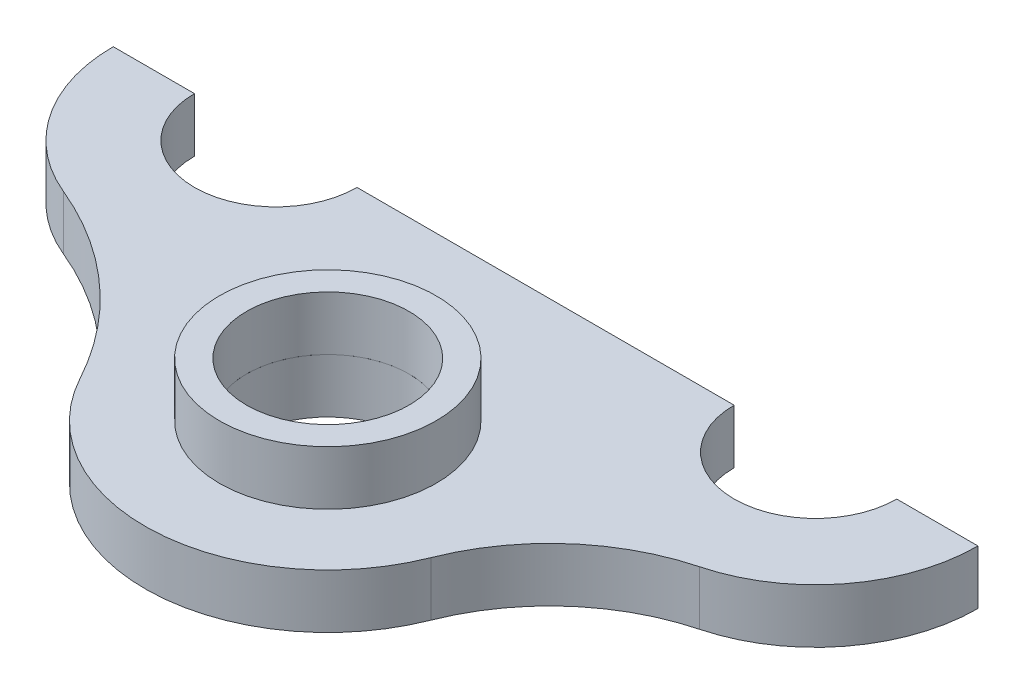
from build123d import *

# Parameters (mm, degrees)
SKETCH1_R           = 2.38125
BOSS_EXTRUDE1_DEPTH = 1.5875
SKETCH2_R           = 3.175
BOSS_EXTRUDE2_DEPTH = 1.5875
SKETCH3_R           = 2.38125
BOSS_EXTRUDE3_DEPTH = 19.05
SKETCH4_R           = 3.175
BOSS_EXTRUDE4_DEPTH = 1.5875
SKETCH5_R           = 2.38125
BOSS_EXTRUDE5_DEPTH = 1.5875
SKETCH6_R           = 2.38125
CUT_EXTRUDE1_DEPTH  = 28.662025878
SKETCH7_W           = 40.69090725
SKETCH7_H           = 20.005301762
CUT_EXTRUDE2_DEPTH  = 26.381492779
CUT_EXTRUDE3_DEPTH  = 19.487872394


with BuildPart() as part:
    # Sketch1 → Boss-Extrude1 (new body)
    with BuildSketch(Plane(origin=(0, 0, 0), x_dir=(1, 0, 0), z_dir=(0, 1, 0))):
        with BuildLine():
            Line((9.398005644, 4.762076723), (-6.35, 4.7625))
            ThreePointArc((-6.35, 4.7625), (-11.020584629, 0.931152767), (-8.176363381, -4.398386414))
            ThreePointArc((-8.176363381, -4.398386414), (-5.292234705, -6.221263486), (-3.181508348, -8.901918869))
            ThreePointArc((-3.181508348, -8.901918869), (1.849687492, -11.693035316), (6.504625866, -8.311495529))
            ThreePointArc((6.504625866, -8.311495529), (8.146827792, -5.96033805), (10.67447942, -4.60544104))
            ThreePointArc((10.67447942, -4.60544104), (14.180390361, 0.643024113), (9.398005644, 4.762076723))
        make_face()
        with Locations(Location((-6.35, 0, 0), (0, 0, 270))):
            Circle(SKETCH1_R, mode=Mode.SUBTRACT)
        with Locations(Location((9.4615, 0, 0), (0, 0, 270))):
            Circle(SKETCH1_R, mode=Mode.SUBTRACT)
        with Locations(Location((1.524, -6.35, 0), (0, 0, 270))):
            Circle(SKETCH1_R, mode=Mode.SUBTRACT)
    extrude(amount=BOSS_EXTRUDE1_DEPTH)

    # Sketch2 → Boss-Extrude2 (add)
    with BuildSketch(Plane.XZ):
        with Locations(Location((1.524, 6.35, 0), (0, 0, 90))):
            Circle(SKETCH2_R)
    extrude(amount=BOSS_EXTRUDE2_DEPTH)

    # Sketch3 → Boss-Extrude3 (add)
    with BuildSketch(Plane(origin=(0, 0, 0), x_dir=(1, 0, 0), z_dir=(0, 1, 0))):
        with Locations(Location((1.524, -6.35, 0), (0, 0, 90))):
            Circle(SKETCH3_R)
    extrude(amount=BOSS_EXTRUDE3_DEPTH)

    # Sketch4 → Boss-Extrude4 (add)
    with BuildSketch(Plane(origin=(0, 19.05, 0), x_dir=(1, 0, 0), z_dir=(0, 1, 0))):
        with Locations(Location((1.524, -6.35, 0), (0, 0, 270))):
            Circle(SKETCH4_R)
    extrude(amount=-BOSS_EXTRUDE4_DEPTH)

    # Sketch6 → Cut-Extrude1 (cut, through all)
    with BuildSketch(Plane(origin=(0, 19.05, 0), x_dir=(1, 0, 0), z_dir=(0, 1, 0))):
        with Locations(Location((1.524, -6.35, 0), (0, 0, 90))):
            Circle(SKETCH6_R)
    extrude(amount=-CUT_EXTRUDE1_DEPTH, mode=Mode.SUBTRACT)


with BuildPart() as body_2:
    # Sketch5 → Boss-Extrude5 (new body)
    with BuildSketch(Plane.XZ.offset(-17.4625)):
        with BuildLine():
            ThreePointArc((-8.176363381, 4.398386414), (-11.020584629, -0.931152767), (-6.35, -4.7625))
            Line((-6.35, -4.7625), (9.4615, -4.7625))
            ThreePointArc((9.4615, -4.7625), (14.184572051, -0.611552653), (10.67447942, 4.60544104))
            ThreePointArc((10.67447942, 4.60544104), (8.146827792, 5.96033805), (6.504625866, 8.311495529))
            ThreePointArc((6.504625866, 8.311495529), (1.849687492, 11.693035316), (-3.181508348, 8.901918869))
            ThreePointArc((-3.181508348, 8.901918869), (-5.292234705, 6.221263486), (-8.176363381, 4.398386414))
        make_face()
        with Locations(Location((-6.35, 0, 0), (0, 0, 270))):
            Circle(SKETCH5_R, mode=Mode.SUBTRACT)
        with Locations(Location((9.4615, 0, 0), (0, 0, 270))):
            Circle(SKETCH5_R, mode=Mode.SUBTRACT)
        with Locations(Location((1.524, 6.35, 0), (0, 0, 270))):
            Circle(SKETCH5_R, mode=Mode.SUBTRACT)
    extrude(amount=BOSS_EXTRUDE5_DEPTH)

    # Sketch8 → Cut-Extrude3 (cut, through all)
    with BuildSketch(Plane(origin=(0, 17.4625, 0), x_dir=(1, 0, 0), z_dir=(0, 1, 0))):
        with BuildLine():
            ThreePointArc((7.08025, 0), (9.4615, 2.38125), (11.84275, 0))
            Line((11.84275, 0), (14.224, 0))
            ThreePointArc((14.224, 0), (12.829096045, 3.367596045), (9.4615, 4.7625))
            Line((9.4615, 4.7625), (-6.35, 4.7625))
            ThreePointArc((-6.35, 4.7625), (-9.717596045, 3.367596045), (-11.1125, 0))
            Line((-11.1125, 0), (-8.73125, 0))
            ThreePointArc((-8.73125, 0), (-6.35, 2.38125), (-3.96875, 0))
            Line((-3.96875, 0), (7.08025, 0))
        make_face()
    extrude(amount=-CUT_EXTRUDE3_DEPTH, mode=Mode.SUBTRACT)


with BuildPart() as cut_extrude1_piece_1:
    # of the separate pieces the step leaves, piece 1, a body of its own (cut_extrude1_pieces)
    add(part.part.solids().sort_by_distance((9.398005644, 0, -4.762076723))[0])

    # Sketch7 → Cut-Extrude2 (cut, through all)
    with BuildSketch(Plane(origin=(0, 1.5875, 0), x_dir=(1, 0, 0), z_dir=(0, 1, 0))):
        with Locations((0.04887425, -4.128782639)):
            Rectangle(SKETCH7_W, SKETCH7_H)
    extrude(amount=-CUT_EXTRUDE2_DEPTH, mode=Mode.SUBTRACT)


with BuildPart() as cut_extrude1_piece_2:
    # of the separate pieces the step leaves, piece 2, a body of its own (cut_extrude1_pieces)
    add(part.part.solids().sort_by_distance((1.524, 17.4625, 9.525))[0])


solid = Compound([body_2.part, cut_extrude1_piece_2.part])
